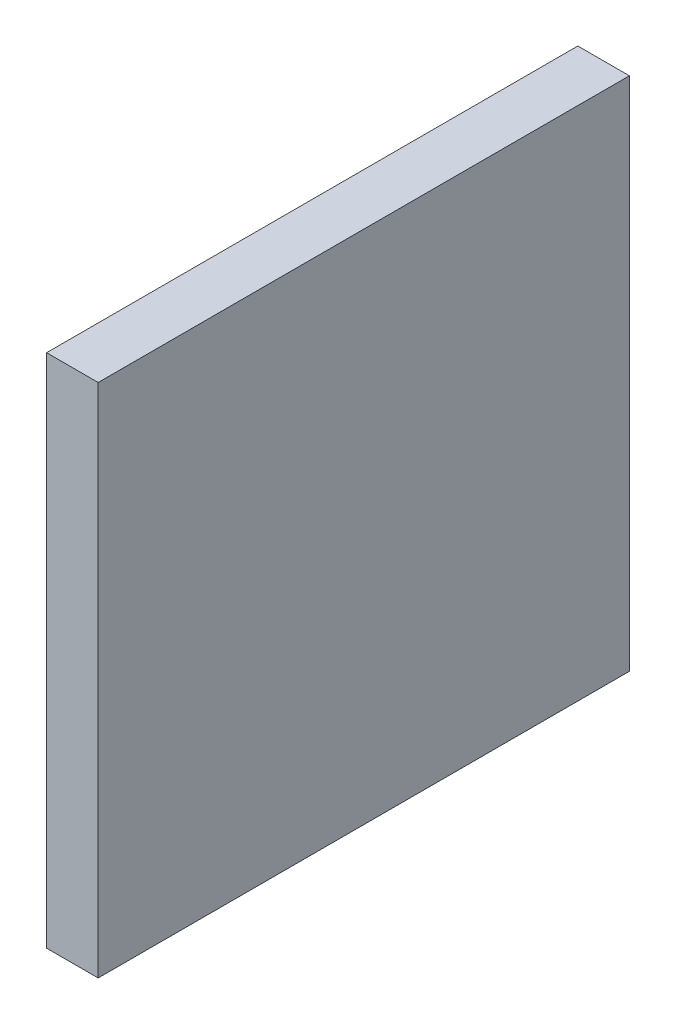
from build123d import *

# Parameters (mm, degrees)
SKETCH1_W           = 10.3
SKETCH1_H           = 10
BOSS_EXTRUDE1_DEPTH = 1


with BuildPart() as part:
    # Sketch1 → Boss-Extrude1 (new body)
    with BuildSketch(Plane(origin=(0, 0, 0), x_dir=(0, 0, -1), z_dir=(1, 0, 0))):
        Rectangle(SKETCH1_W, SKETCH1_H)
    extrude(amount=BOSS_EXTRUDE1_DEPTH)


solid = part.part
